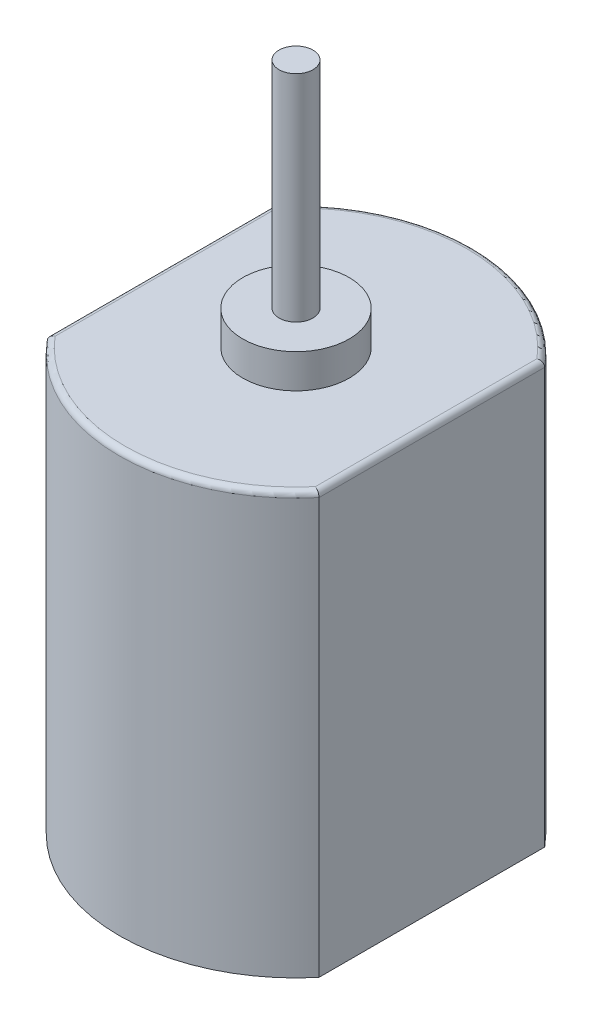
from build123d import *

# Parameters (mm, degrees)
BOSS_EXTRUDE1_DEPTH = 18.6
BOSS_EXTRUDE2_DEPTH = 2.2
SKETCH3_R           = 2.35
BOSS_EXTRUDE3_DEPTH = 1.5
SKETCH4_R           = 0.75
BOSS_EXTRUDE4_DEPTH = 9.5
FILLET2_R           = 0.25


with BuildPart() as part:
    # Sketch1 → Boss-Extrude1 (new body)
    with BuildSketch(Plane(origin=(0, 0, 0), x_dir=(1, 0, 0), z_dir=(0, 1, 0))):
        with BuildLine():
            Line((-6, 4.983974318), (-6, -4.983974318))
            ThreePointArc((-6, -4.983974318), (0, -7.8), (6, -4.983974318))
            Line((6, -4.983974318), (6, 4.983974318))
            ThreePointArc((6, 4.983974318), (0, 7.8), (-6, 4.983974318))
        make_face()
    extrude(amount=BOSS_EXTRUDE1_DEPTH)

    # Sketch2 → Boss-Extrude2 (add)
    with BuildSketch(Plane.XZ):
        Polygon((1.212939296, -4.265123476), (1.095719957, -3.98897202), (-0.285037323, -4.575068713), (-0.167817984, -4.851220169), align=None)
        Polygon((0.285037323, 4.575068713), (0.167817984, 4.851220169), (-1.212939296, 4.265123476), (-1.095719957, 3.98897202), align=None)
    extrude(amount=BOSS_EXTRUDE2_DEPTH)

    # Sketch3 → Boss-Extrude3 (add)
    with BuildSketch(Plane(origin=(0, 18.6, 0), x_dir=(1, 0, 0), z_dir=(0, 1, 0))):
        with Locations(Location((0, 0, 0), (0, 0, 270))):
            Circle(SKETCH3_R)
    extrude(amount=BOSS_EXTRUDE3_DEPTH)

    # Sketch4 → Boss-Extrude4 (add)
    with BuildSketch(Plane(origin=(0, 20.1, 0), x_dir=(1, 0, 0), z_dir=(0, 1, 0))):
        with Locations(Location((0, 0, 0), (0, 0, 270))):
            Circle(SKETCH4_R)
    extrude(amount=BOSS_EXTRUDE4_DEPTH)

    # Fillet2
    fillet2_edges = [part.edges().sort_by_distance(p)[0] for p in [
        (0, 18.6, 7.8),
        (6, 18.6, 0),
        (0, 18.6, -7.8),
        (-6, 18.6, 0),
    ]]
    fillet(fillet2_edges, radius=FILLET2_R)


solid = part.part
